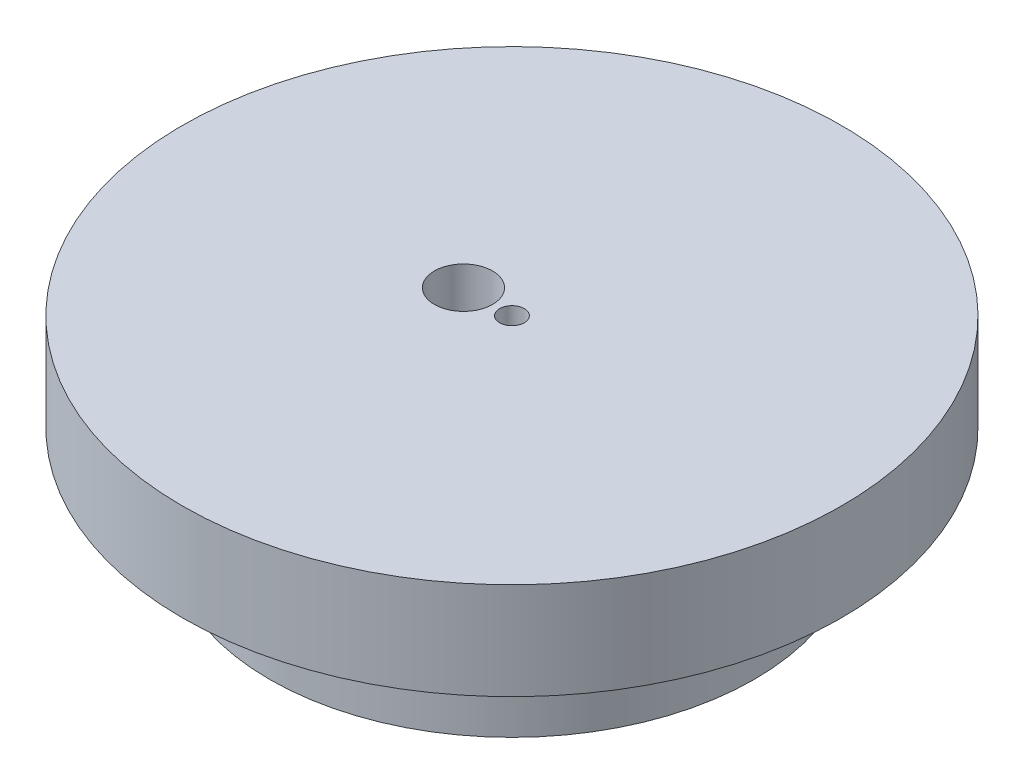
from build123d import *

# Parameters (mm, degrees)
SKETCH1_R           = 25
BOSS_EXTRUDE1_DEPTH = 10
SKETCH2_R           = 34
SKETCH2_R_2         = 1.27
BOSS_EXTRUDE2_DEPTH = 10
SKETCH3_R           = 3
CUT_EXTRUDE1_DEPTH  = 53.076866265


with BuildPart() as part:
    # Sketch1 → Boss-Extrude1 (new body)
    with BuildSketch(Plane(origin=(0, 0, 0), x_dir=(1, 0, 0), z_dir=(0, 1, 0))):
        with Locations(Location((0, 0, 0), (0, 0, 270))):
            Circle(SKETCH1_R)
        with BuildLine():
            Line((-1.503409091, 11.025), (1.503409091, 11.025))
            Line((1.503409091, 11.025), (2.431438314, 8.164979486))
            ThreePointArc((2.431438314, 8.164979486), (3.260201923, 7.870823699), (4.054225843, 7.492798883))
            Line((4.054225843, 7.492798883), (6.7327815, 8.858923026))
            Line((6.7327815, 8.858923026), (8.858923026, 6.7327815))
            Line((8.858923026, 6.7327815), (7.492798883, 4.054225843))
            ThreePointArc((7.492798883, 4.054225843), (7.870823699, 3.260201923), (8.164979486, 2.431438314))
            Line((8.164979486, 2.431438314), (11.025, 1.503409091))
            Line((11.025, 1.503409091), (11.025, -1.503409091))
            Line((11.025, -1.503409091), (8.164979486, -2.431438314))
            ThreePointArc((8.164979486, -2.431438314), (7.870823699, -3.260201923), (7.492798883, -4.054225843))
            Line((7.492798883, -4.054225843), (8.858923026, -6.7327815))
            Line((8.858923026, -6.7327815), (6.7327815, -8.858923026))
            Line((6.7327815, -8.858923026), (4.054225843, -7.492798883))
            ThreePointArc((4.054225843, -7.492798883), (3.260201923, -7.870823699), (2.431438314, -8.164979486))
            Line((2.431438314, -8.164979486), (1.503409091, -11.025))
            Line((1.503409091, -11.025), (-1.503409091, -11.025))
            Line((-1.503409091, -11.025), (-2.431438314, -8.164979486))
            ThreePointArc((-2.431438314, -8.164979486), (-3.260201923, -7.870823699), (-4.054225843, -7.492798883))
            Line((-4.054225843, -7.492798883), (-6.7327815, -8.858923026))
            Line((-6.7327815, -8.858923026), (-8.858923026, -6.7327815))
            Line((-8.858923026, -6.7327815), (-7.492798883, -4.054225843))
            ThreePointArc((-7.492798883, -4.054225843), (-7.870823699, -3.260201923), (-8.164979486, -2.431438314))
            Line((-8.164979486, -2.431438314), (-11.025, -1.503409091))
            Line((-11.025, -1.503409091), (-11.025, 1.503409091))
            Line((-11.025, 1.503409091), (-8.164979486, 2.431438314))
            ThreePointArc((-8.164979486, 2.431438314), (-7.870823699, 3.260201923), (-7.492798883, 4.054225843))
            Line((-7.492798883, 4.054225843), (-8.858923026, 6.7327815))
            Line((-8.858923026, 6.7327815), (-6.7327815, 8.858923026))
            Line((-6.7327815, 8.858923026), (-4.054225843, 7.492798883))
            ThreePointArc((-4.054225843, 7.492798883), (-3.260201923, 7.870823699), (-2.431438314, 8.164979486))
            Line((-2.431438314, 8.164979486), (-1.503409091, 11.025))
        make_face(mode=Mode.SUBTRACT)
    extrude(amount=BOSS_EXTRUDE1_DEPTH)

    # Sketch2 → Boss-Extrude2 (add)
    with BuildSketch(Plane(origin=(0, 10, 0), x_dir=(1, 0, 0), z_dir=(0, 1, 0))):
        with Locations(Location((0, 0, 0), (0, 0, 270))):
            Circle(SKETCH2_R)
        with Locations(Location((0, 0, 0), (0, 0, 270))):
            Circle(SKETCH2_R_2, mode=Mode.SUBTRACT)
    extrude(amount=BOSS_EXTRUDE2_DEPTH)

    # Sketch3 → Cut-Extrude1 (cut, through all)
    with BuildSketch(Plane(origin=(0, 20, 0), x_dir=(1, 0, 0), z_dir=(0, 1, 0))):
        with Locations(Location((-5, 0, 0), (0, 0, 270))):
            Circle(SKETCH3_R)
    extrude(amount=-CUT_EXTRUDE1_DEPTH, mode=Mode.SUBTRACT)


solid = part.part
